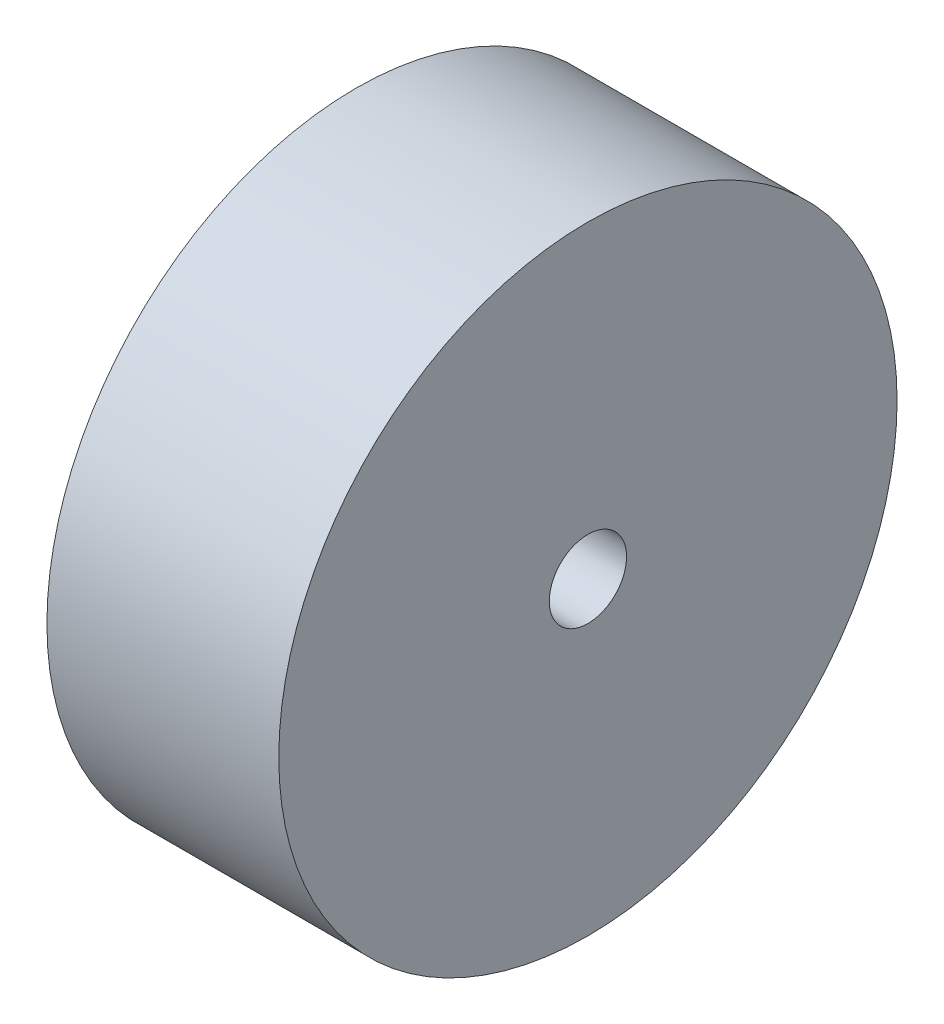
from build123d import *

# Parameters (mm, degrees)
SKETCH1_R           = 101.6
SKETCH1_R_2         = 12.7
BOSS_EXTRUDE1_DEPTH = 76.2


with BuildPart() as part:
    # Sketch1 → Boss-Extrude1 (new body)
    with BuildSketch(Plane(origin=(0, 0, 0), x_dir=(0, 0, -1), z_dir=(1, 0, 0))):
        Circle(SKETCH1_R)
        Circle(SKETCH1_R_2, mode=Mode.SUBTRACT)
    extrude(amount=BOSS_EXTRUDE1_DEPTH)


solid = part.part
